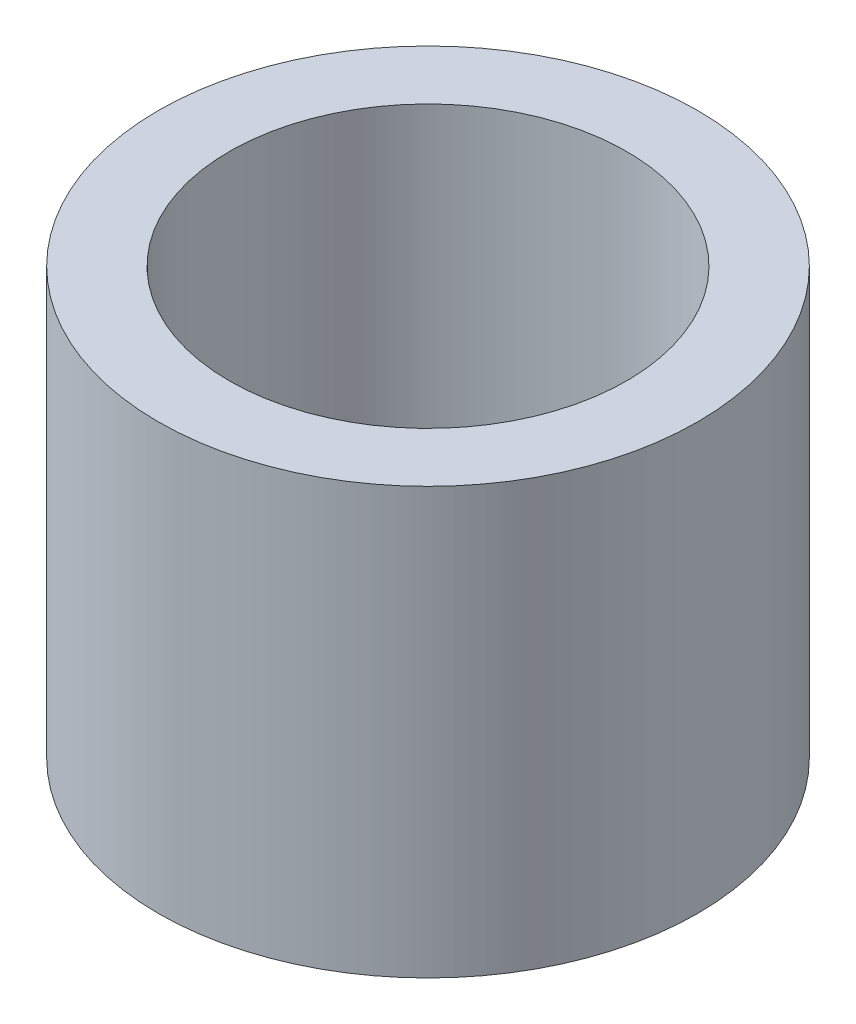
from build123d import *

# Parameters (mm, degrees)
SKETCH2_R           = 4.75
SKETCH2_R_2         = 3.5
BOSS_EXTRUDE1_DEPTH = 3.75


with BuildPart() as part:
    # Sketch2 → Boss-Extrude1 (new, symmetric)
    with BuildSketch(Plane(origin=(0, 0, 0), x_dir=(1, 0, 0), z_dir=(0, 1, 0))):
        with Locations(Location((0, 0, 0), (0, 0, 270))):
            Circle(SKETCH2_R)
        with Locations(Location((0, 0, 0), (0, 0, 270))):
            Circle(SKETCH2_R_2, mode=Mode.SUBTRACT)
    extrude(amount=BOSS_EXTRUDE1_DEPTH, both=True)


solid = part.part
